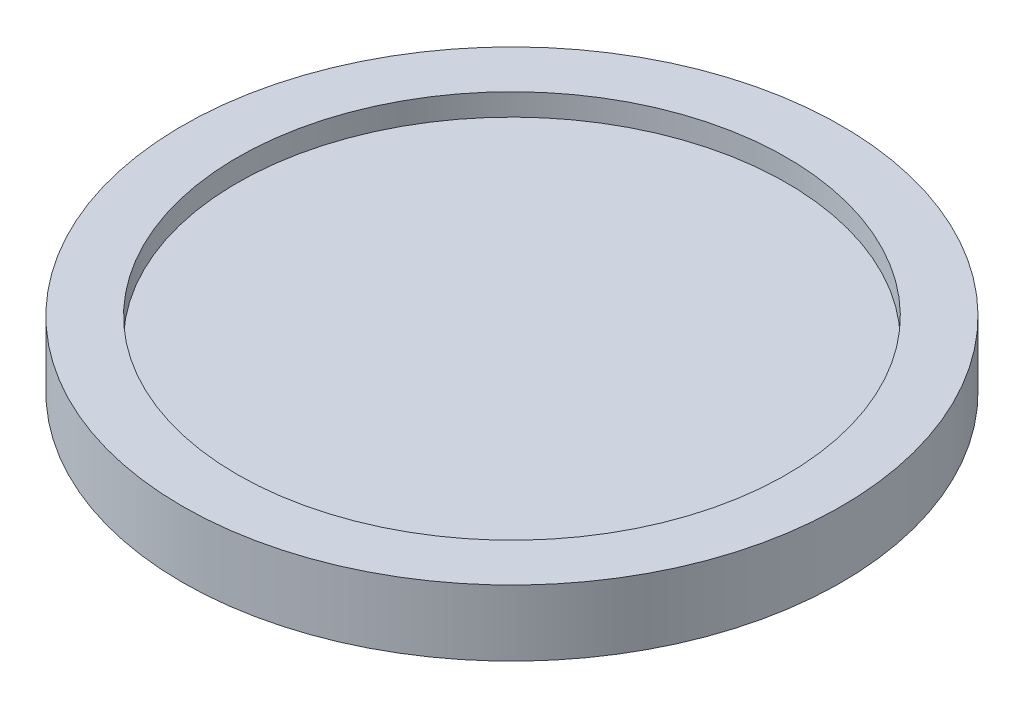
from build123d import *

# Parameters (mm, degrees)
SKETCH_1_R          = 30
EXTRUDE_3_DEPTH     = 6
SKETCH_6_R          = 25
CUT_EXTRUDE_1_DEPTH = 2
CUT_EXTRUDE_START   = 4
SKETCH_4_R          = 25
CUT_EXTRUDE_2_DEPTH = 2
SKETCH_8_R          = 6
EXTRUDE_5_DEPTH     = 10
SKETCH_10_R         = 2
CUT_EXTRUDE_6_DEPTH = 10


with BuildPart() as part:
    # 草图1 → 凸台-拉伸3 (new body)
    with BuildSketch(Plane(origin=(0, 0, 0), x_dir=(1, 0, 0), z_dir=(0, 1, 0))):
        with Locations(Location((0, 0, 0), (0, 0, 270))):
            Circle(SKETCH_1_R)
    extrude(amount=EXTRUDE_3_DEPTH)

    # 草图6 → 切除-拉伸1 (cut)
    with BuildSketch(Plane.XZ):
        with Locations(Location((0, 0, 0), (0, 0, 270))):
            Circle(SKETCH_6_R)
    extrude(amount=-CUT_EXTRUDE_1_DEPTH, mode=Mode.SUBTRACT)

    # 草图4 → 切除-拉伸2 (cut)
    with BuildSketch(Plane(origin=(0, 0, 0), x_dir=(1, 0, 0), z_dir=(0, 1, 0)).offset(CUT_EXTRUDE_START)):
        with Locations(Location((0, 0, 0), (0, 0, 90))):
            Circle(SKETCH_4_R)
    extrude(amount=CUT_EXTRUDE_2_DEPTH, mode=Mode.SUBTRACT)

    # 草图8 → 凸台-拉伸5 (add)
    with BuildSketch(Plane(origin=(0, 2, 0), x_dir=(-1, 0, 0), z_dir=(0, -1, 0))):
        with Locations(Location((0, 0, 0), (0, 0, 90))):
            Circle(SKETCH_8_R)
    extrude(amount=EXTRUDE_5_DEPTH)

    # 草图10 → 切除-拉伸6 (cut)
    with BuildSketch(Plane(origin=(0, -8, 0), x_dir=(-1, 0, 0), z_dir=(0, -1, 0))):
        with Locations(Location((0, 0, 0), (0, 0, 90))):
            Circle(SKETCH_10_R)
    extrude(amount=-CUT_EXTRUDE_6_DEPTH, mode=Mode.SUBTRACT)


solid = part.part
